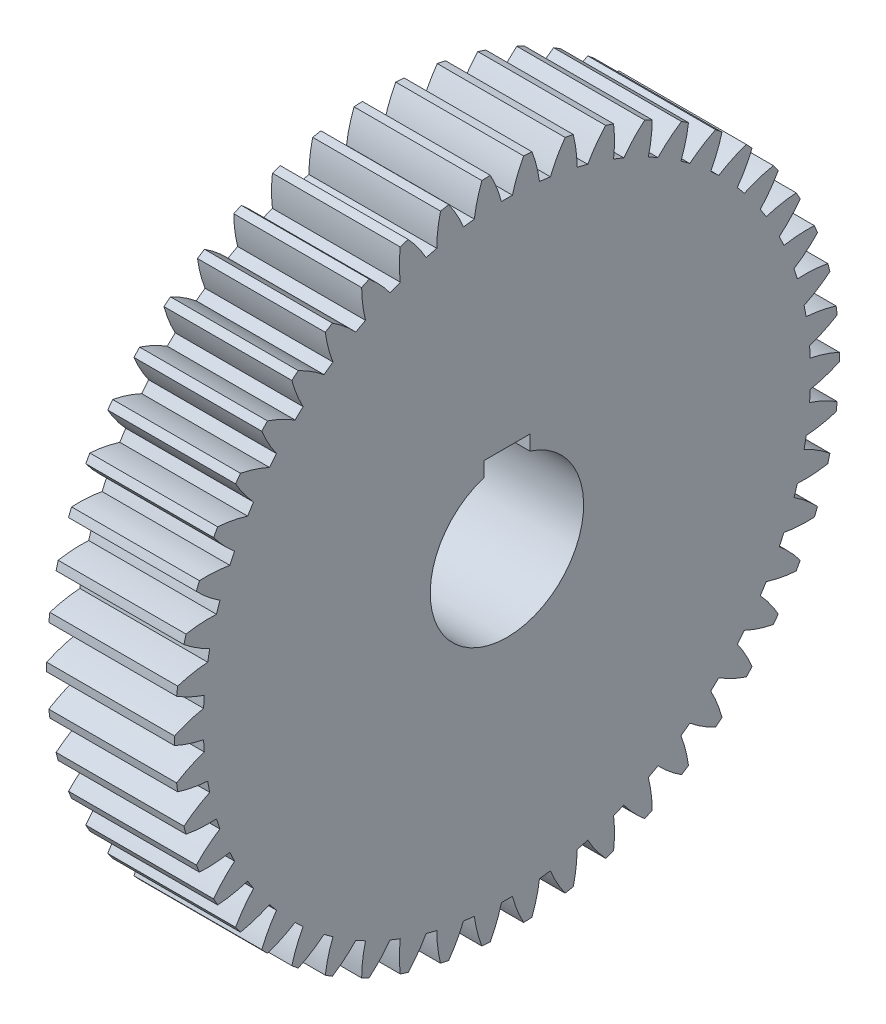
from build123d import *

# Parameters (mm, degrees)
BASPROSKE_W     = 50
BASPROSKE_H     = 130
TOOTHCUT_DEPTH  = 191.525588833
TEETHCUTS_COUNT = 50
TEETHCUTS_ANGLE = 352.8
BORSKE_R        = 30
BORE_DEPTH      = 50.0000508
KEYSKE_W        = 18
KEYSKE_H        = 34.4
KEYWAY_DEPTH    = 50.0000508


with BuildPart() as part:
    # BasProSke → Base-Revolve (revolve)
    with BuildSketch(Plane(origin=(0, 0, 0), x_dir=(1, 0, 0), z_dir=(0, 1, 0)), mode=Mode.PRIVATE) as base_revolve_sk:
        with Locations((25, 65)):
            Rectangle(BASPROSKE_W, BASPROSKE_H)
    revolve(base_revolve_sk.sketch.rotate(Axis((-10, 0, 0), (1, 0, 0)), 180), axis=Axis((-10, 0, 0), (1, 0, 0)))

    # TooCutSke → ToothCut (cut, through all)
    with BuildSketch(Plane(origin=(0, 0, 0), x_dir=(0, 0, -1), z_dir=(1, 0, 0))):
        with BuildLine():
            ThreePointArc((2.151115704, 118.729514874), (0, 118.749), (-2.151115704, 118.729514874))
            ThreePointArc((-2.151115704, 118.729514874), (-4.017060073, 124.427023972), (-6.551524935, 129.860240898))
            ThreePointArc((-6.551524935, 129.860240898), (0, 130.0254), (6.551524935, 129.860240898))
            ThreePointArc((6.551524935, 129.860240898), (4.017060073, 124.427023972), (2.151115704, 118.729514874))
        make_face()
    toothcut = extrude(amount=TOOTHCUT_DEPTH, mode=Mode.SUBTRACT)

    # TeethCuts: ToothCut ×50 about axis
    teethcuts_axis = Axis((-10, 0, 0), (1, 0, 0))
    for i in range(1, TEETHCUTS_COUNT):
        add(toothcut.rotate(teethcuts_axis, i * TEETHCUTS_ANGLE / (TEETHCUTS_COUNT - 1)), mode=Mode.SUBTRACT)

    # BorSke → Bore (cut, symmetric)
    with BuildSketch(Plane(origin=(0, 0, 0), x_dir=(0, 0, -1), z_dir=(1, 0, 0))):
        with Locations(Location((0, 0, 0), (0, 0, 180))):
            Circle(BORSKE_R)
    extrude(amount=BORE_DEPTH, both=True, mode=Mode.SUBTRACT)

    # KeySke → Keyway (cut, symmetric)
    with BuildSketch(Plane(origin=(0, 0, 0), x_dir=(0, 0, -1), z_dir=(1, 0, 0))):
        with Locations((0, 17.2)):
            Rectangle(KEYSKE_W, KEYSKE_H)
    extrude(amount=KEYWAY_DEPTH, both=True, mode=Mode.SUBTRACT)


solid = part.part
